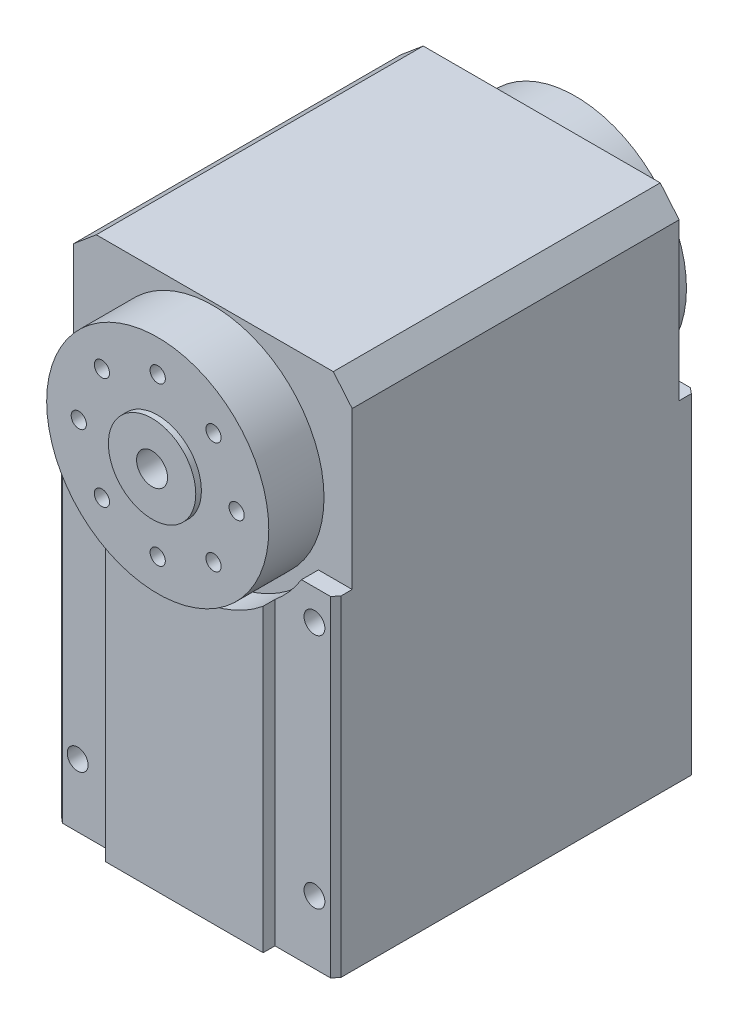
from build123d import *
from OCP.BRepFilletAPI import BRepFilletAPI_MakeChamfer

# Parameters (mm, degrees)
SKETCH1_R               = 9.85
SKETCH1_R_2             = 0.675
BOSS_EXTRUDE1_DEPTH     = 14.5
BOSS_EXTRUDE2_DEPTH     = 16
BOSS_EXTRUDE3_START     = 14.5
SKETCH1_4_R             = 9.85
SKETCH1_4_R_2           = 0.675
BOSS_EXTRUDE3_DEPTH     = 4.9
BOSS_EXTRUDE4_START     = -17.65
SKETCH1_5_R             = 9.85
SKETCH1_5_R_2           = 0.675
BOSS_EXTRUDE4_DEPTH     = 3.15
BOSS_EXTRUDE5_START     = 1.05
BOSS_EXTRUDE5_DEPTH     = 1.05
SKETCH3_W               = 18.5
SKETCH3_H               = 13.5
BOSS_EXTRUDE6_DEPTH     = 1.85
CHAMFER1_SIZE           = 2.1
CHAMFER1_SIZE2          = 1.762109225
BOSS_EXTRUDE7_DEPTH     = 1.5
CUT_EXTRUDE1_START      = 16
SKETCH4_R               = 0.925
CUT_EXTRUDE1_DEPTH      = 5
CUT_EXTRUDE2_START      = -11
SKETCH4_3_R             = 0.925
CUT_EXTRUDE2_DEPTH      = 5
CHAMFER2_SIZE           = 2
CHAMFER2_SIZE2          = 1.678199262
CHAMFER3_SIZE           = 0.5
CHAMFER3_SIZE2          = 0.419549816
BOSS_EXTRUDE8_START     = 19.4
SKETCH5_R               = 3.875
BOSS_EXTRUDE8_DEPTH     = 0.5
BOSS_EXTRUDE9_START     = -18.2
SKETCH5_2_R             = 3.875
BOSS_EXTRUDE9_DEPTH     = 0.55
CUT_EXTRUDE3_DEPTH      = 43.196474971
CUT_EXTRUDE3_DEPTH_BACK = 43.196474971
SKETCH6_R               = 1.375


with BuildPart() as part:
    # Sketch1 → Boss-Extrude1 (new, symmetric)
    # profile 1 of 11: a face of its own
    with BuildSketch(Plane.XY):
        with BuildLine():
            Line((-12.35, 10.1), (-12.35, -5.794609564))
            Line((-12.35, -5.794609564), (-9.35, -5.794609564))
            ThreePointArc((-9.35, -5.794609564), (0, -11), (9.35, -5.794609564))
            Line((9.35, -5.794609564), (12.35, -5.794609564))
            Line((12.35, -5.794609564), (12.35, 10.1))
            Line((12.35, 10.1), (-12.35, 10.1))
        make_face()
        Circle(SKETCH1_R, mode=Mode.SUBTRACT)
    # profile 2 of 11: a face of its own
    with BuildSketch(Plane.XY):
        Circle(SKETCH1_R)
        with Locations((-4.949747468, 4.949747468)):
            Circle(SKETCH1_R_2, mode=Mode.SUBTRACT)
        with Locations((-7, 0)):
            Circle(SKETCH1_R_2, mode=Mode.SUBTRACT)
        with Locations((-4.949747468, -4.949747468)):
            Circle(SKETCH1_R_2, mode=Mode.SUBTRACT)
        with Locations((0, -7)):
            Circle(SKETCH1_R_2, mode=Mode.SUBTRACT)
        with Locations((4.949747468, -4.949747468)):
            Circle(SKETCH1_R_2, mode=Mode.SUBTRACT)
        with Locations((7, 0)):
            Circle(SKETCH1_R_2, mode=Mode.SUBTRACT)
        with Locations((4.949747468, 4.949747468)):
            Circle(SKETCH1_R_2, mode=Mode.SUBTRACT)
        with Locations((0, 7)):
            Circle(SKETCH1_R_2, mode=Mode.SUBTRACT)
    # profile 3 of 11: a face of its own
    with BuildSketch(Plane.XY):
        with Locations((-4.949747468, 4.949747468)):
            Circle(SKETCH1_R_2)
    # profile 4 of 11: a face of its own
    with BuildSketch(Plane.XY):
        with Locations((-7, 0)):
            Circle(SKETCH1_R_2)
    # profile 5 of 11: a face of its own
    with BuildSketch(Plane.XY):
        with Locations((-4.949747468, -4.949747468)):
            Circle(SKETCH1_R_2)
    # profile 6 of 11: a face of its own
    with BuildSketch(Plane.XY):
        with Locations((0, -7)):
            Circle(SKETCH1_R_2)
    # profile 7 of 11: a face of its own
    with BuildSketch(Plane.XY):
        with Locations((4.949747468, -4.949747468)):
            Circle(SKETCH1_R_2)
    # profile 8 of 11: a face of its own
    with BuildSketch(Plane.XY):
        with Locations((7, 0)):
            Circle(SKETCH1_R_2)
    # profile 9 of 11: a face of its own
    with BuildSketch(Plane.XY):
        with Locations((4.949747468, 4.949747468)):
            Circle(SKETCH1_R_2)
    # profile 10 of 11: a face of its own
    with BuildSketch(Plane.XY):
        with Locations((0, 7)):
            Circle(SKETCH1_R_2)
    # profile 11 of 11: a face of its own
    with BuildSketch(Plane.XY):
        with BuildLine():
            Line((-9.35, -5.794609564), (-12.35, -5.794609564))
            Line((-12.35, -5.794609564), (-12.35, -35.1))
            Line((-12.35, -35.1), (12.35, -35.1))
            Line((12.35, -35.1), (12.35, -5.794609564))
            Line((12.35, -5.794609564), (9.35, -5.794609564))
            ThreePointArc((9.35, -5.794609564), (0, -11), (-9.35, -5.794609564))
        make_face()
    extrude(amount=BOSS_EXTRUDE1_DEPTH, both=True)

    # Sketch1<3> → Boss-Extrude2 (add, symmetric)
    with BuildSketch(Plane.XY):
        with BuildLine():
            Line((-9.35, -5.794609564), (-12.35, -5.794609564))
            Line((-12.35, -5.794609564), (-12.35, -35.1))
            Line((-12.35, -35.1), (12.35, -35.1))
            Line((12.35, -35.1), (12.35, -5.794609564))
            Line((12.35, -5.794609564), (9.35, -5.794609564))
            ThreePointArc((9.35, -5.794609564), (0, -11), (-9.35, -5.794609564))
        make_face()
    extrude(amount=BOSS_EXTRUDE2_DEPTH, both=True)

    # Sketch1<4> → Boss-Extrude3 (add)
    with BuildSketch(Plane.XY.offset(BOSS_EXTRUDE3_START)):
        Circle(SKETCH1_4_R)
        with Locations((0, 7)):
            Circle(SKETCH1_4_R_2, mode=Mode.SUBTRACT)
        with Locations((4.949747468, 4.949747468)):
            Circle(SKETCH1_4_R_2, mode=Mode.SUBTRACT)
        with Locations((7, 0)):
            Circle(SKETCH1_4_R_2, mode=Mode.SUBTRACT)
        with Locations((4.949747468, -4.949747468)):
            Circle(SKETCH1_4_R_2, mode=Mode.SUBTRACT)
        with Locations((0, -7)):
            Circle(SKETCH1_4_R_2, mode=Mode.SUBTRACT)
        with Locations((-4.949747468, -4.949747468)):
            Circle(SKETCH1_4_R_2, mode=Mode.SUBTRACT)
        with Locations((-7, 0)):
            Circle(SKETCH1_4_R_2, mode=Mode.SUBTRACT)
        with Locations((-4.949747468, 4.949747468)):
            Circle(SKETCH1_4_R_2, mode=Mode.SUBTRACT)
    extrude(amount=BOSS_EXTRUDE3_DEPTH)

    # Sketch1<5> → Boss-Extrude4 (add)
    with BuildSketch(Plane.XY.offset(BOSS_EXTRUDE4_START)):
        Circle(SKETCH1_5_R)
        with Locations((0, 7)):
            Circle(SKETCH1_5_R_2, mode=Mode.SUBTRACT)
        with Locations((4.949747468, 4.949747468)):
            Circle(SKETCH1_5_R_2, mode=Mode.SUBTRACT)
        with Locations((7, 0)):
            Circle(SKETCH1_5_R_2, mode=Mode.SUBTRACT)
        with Locations((4.949747468, -4.949747468)):
            Circle(SKETCH1_5_R_2, mode=Mode.SUBTRACT)
        with Locations((0, -7)):
            Circle(SKETCH1_5_R_2, mode=Mode.SUBTRACT)
        with Locations((-4.949747468, -4.949747468)):
            Circle(SKETCH1_5_R_2, mode=Mode.SUBTRACT)
        with Locations((-7, 0)):
            Circle(SKETCH1_5_R_2, mode=Mode.SUBTRACT)
        with Locations((-4.949747468, 4.949747468)):
            Circle(SKETCH1_5_R_2, mode=Mode.SUBTRACT)
    extrude(amount=BOSS_EXTRUDE4_DEPTH)

    # Sketch2 → Boss-Extrude5 (add)
    with BuildSketch(Plane.XY.offset(16).offset(BOSS_EXTRUDE5_START)):
        with BuildLine():
            Line((-7, -8.485281374), (-7, -35.1))
            Line((-7, -35.1), (7, -35.1))
            Line((7, -35.1), (7, -8.485281374))
            ThreePointArc((7, -8.485281374), (0, -11), (-7, -8.485281374))
        make_face()
    extrude(amount=-BOSS_EXTRUDE5_DEPTH)

    # Sketch3 → Boss-Extrude6 (add)
    with BuildSketch(Plane(origin=(0, 0, -16), x_dir=(-1, 0, 0), z_dir=(0, 0, -1))):
        with Locations((0, -23.75)):
            Rectangle(SKETCH3_W, SKETCH3_H)
    extrude(amount=BOSS_EXTRUDE6_DEPTH)

    # Chamfer1
    chamfer1_edges = [part.edges().sort_by_distance(p)[0] for p in [
        (0, -17, -17.85),
    ]]
    chamfer1_side = [part.faces().sort_by_distance(p)[0] for p in [
        (0, -23.75, -17.85),
    ]]
    chamfer(chamfer1_edges, length=CHAMFER1_SIZE, length2=CHAMFER1_SIZE2, reference=chamfer1_side[0])

    # Sketch3<3> → Boss-Extrude7 (add)
    with BuildSketch(Plane(origin=(0, 0, -16), x_dir=(-1, 0, 0), z_dir=(0, 0, -1))):
        Polygon((-10, -17), (-9.25, -17), (9.25, -17), (10, -17), (10, -12), (-10, -12), align=None)
    extrude(amount=BOSS_EXTRUDE7_DEPTH)

    # Sketch4 → Cut-Extrude1 (cut)
    with BuildSketch(Plane.XY.offset(CUT_EXTRUDE1_START)):
        with Locations((-10.5, -8.5)):
            Circle(SKETCH4_R)
        with Locations((10.5, -8.5)):
            Circle(SKETCH4_R)
        with Locations((-10.5, -29.5)):
            Circle(SKETCH4_R)
        with Locations((10.5, -29.5)):
            Circle(SKETCH4_R)
    extrude(amount=-CUT_EXTRUDE1_DEPTH, mode=Mode.SUBTRACT)

    # Sketch4<3> → Cut-Extrude2 (cut)
    with BuildSketch(Plane.XY.offset(CUT_EXTRUDE2_START)):
        with Locations((10.5, -8.5)):
            Circle(SKETCH4_3_R)
        with Locations((-10.5, -8.5)):
            Circle(SKETCH4_3_R)
        with Locations((-10.5, -33)):
            Circle(SKETCH4_3_R)
        with Locations((10.5, -33)):
            Circle(SKETCH4_3_R)
    extrude(amount=-CUT_EXTRUDE2_DEPTH, mode=Mode.SUBTRACT)

    # Chamfer2: one chamfer whose edges measure the first distance from different faces: ONE call of the kernel's chamfer builder (chamfer() names one face for all edges)
    chamfer2_edges_1 = [part.edges().sort_by_distance(p)[0] for p in [
        (-12.35, 10.1, 0),
    ]]
    chamfer2_side_1 = [part.faces().sort_by_distance(p)[0] for p in [
        (0, 10.1, 0),
    ]]
    chamfer2_edges_2 = [part.edges().sort_by_distance(p)[0] for p in [
        (12.35, 10.1, 0),
    ]]
    chamfer2_side_2 = [part.faces().sort_by_distance(p)[0] for p in [
        (12.35, -12.999527083, 0),
    ]]
    chamfer2 = BRepFilletAPI_MakeChamfer(part.part.solid().wrapped)
    for e in chamfer2_edges_1:
        chamfer2.Add(CHAMFER2_SIZE, CHAMFER2_SIZE2, e.wrapped, chamfer2_side_1[0].wrapped)  # the first distance lies on this face
    for e in chamfer2_edges_2:
        chamfer2.Add(CHAMFER2_SIZE, CHAMFER2_SIZE2, e.wrapped, chamfer2_side_2[0].wrapped)  # the first distance lies on this face
    add(Compound.cast(chamfer2.Shape()), mode=Mode.REPLACE)

    # Chamfer3: one chamfer whose edges measure the first distance from different faces: ONE call of the kernel's chamfer builder (chamfer() names one face for all edges)
    chamfer3_edges_1 = [part.edges().sort_by_distance(p)[0] for p in [
        (12.35, -20.447304782, -16),
    ]]
    chamfer3_side_1 = [part.faces().sort_by_distance(p)[0] for p in [
        (10.85, -6.177871343, -16),
    ]]
    chamfer3_edges_2 = [part.edges().sort_by_distance(p)[0] for p in [
        (-12.35, -20.447304782, 16),
    ]]
    chamfer3_side_2 = [part.faces().sort_by_distance(p)[0] for p in [
        (-9.6888762, -20.825200729, 16),
    ]]
    chamfer3_edges_3 = [part.edges().sort_by_distance(p)[0] for p in [
        (12.35, -20.447304782, 16),
    ]]
    chamfer3_side_3 = [part.faces().sort_by_distance(p)[0] for p in [
        (12.35, -13.955562818, 0),
    ]]
    chamfer3_edges_4 = [part.edges().sort_by_distance(p)[0] for p in [
        (-12.35, -20.447304782, -16),
    ]]
    chamfer3_side_4 = [part.faces().sort_by_distance(p)[0] for p in [
        (-12.35, -13.801991321, 0),
    ]]
    chamfer3 = BRepFilletAPI_MakeChamfer(part.part.solid().wrapped)
    for e in chamfer3_edges_1:
        chamfer3.Add(CHAMFER3_SIZE, CHAMFER3_SIZE2, e.wrapped, chamfer3_side_1[0].wrapped)  # the first distance lies on this face
    for e in chamfer3_edges_2:
        chamfer3.Add(CHAMFER3_SIZE, CHAMFER3_SIZE2, e.wrapped, chamfer3_side_2[0].wrapped)  # the first distance lies on this face
    for e in chamfer3_edges_3:
        chamfer3.Add(CHAMFER3_SIZE, CHAMFER3_SIZE2, e.wrapped, chamfer3_side_3[0].wrapped)  # the first distance lies on this face
    for e in chamfer3_edges_4:
        chamfer3.Add(CHAMFER3_SIZE, CHAMFER3_SIZE2, e.wrapped, chamfer3_side_4[0].wrapped)  # the first distance lies on this face
    add(Compound.cast(chamfer3.Shape()), mode=Mode.REPLACE)

    # Sketch5 → Boss-Extrude8 (add)
    with BuildSketch(Plane.XY.offset(BOSS_EXTRUDE8_START)):
        Circle(SKETCH5_R)
    extrude(amount=BOSS_EXTRUDE8_DEPTH)

    # Sketch5<2> → Boss-Extrude9 (add)
    with BuildSketch(Plane.XY.offset(BOSS_EXTRUDE9_START)):
        Circle(SKETCH5_2_R)
    extrude(amount=BOSS_EXTRUDE9_DEPTH)

    # Sketch6 → Cut-Extrude3 (cut, two sides: drawn at the far end of the back side and taken through both)
    with BuildSketch(Plane.XY.offset(-CUT_EXTRUDE3_DEPTH_BACK)):
        Circle(SKETCH6_R)
    extrude(amount=CUT_EXTRUDE3_DEPTH + CUT_EXTRUDE3_DEPTH_BACK, mode=Mode.SUBTRACT)


solid = part.part
